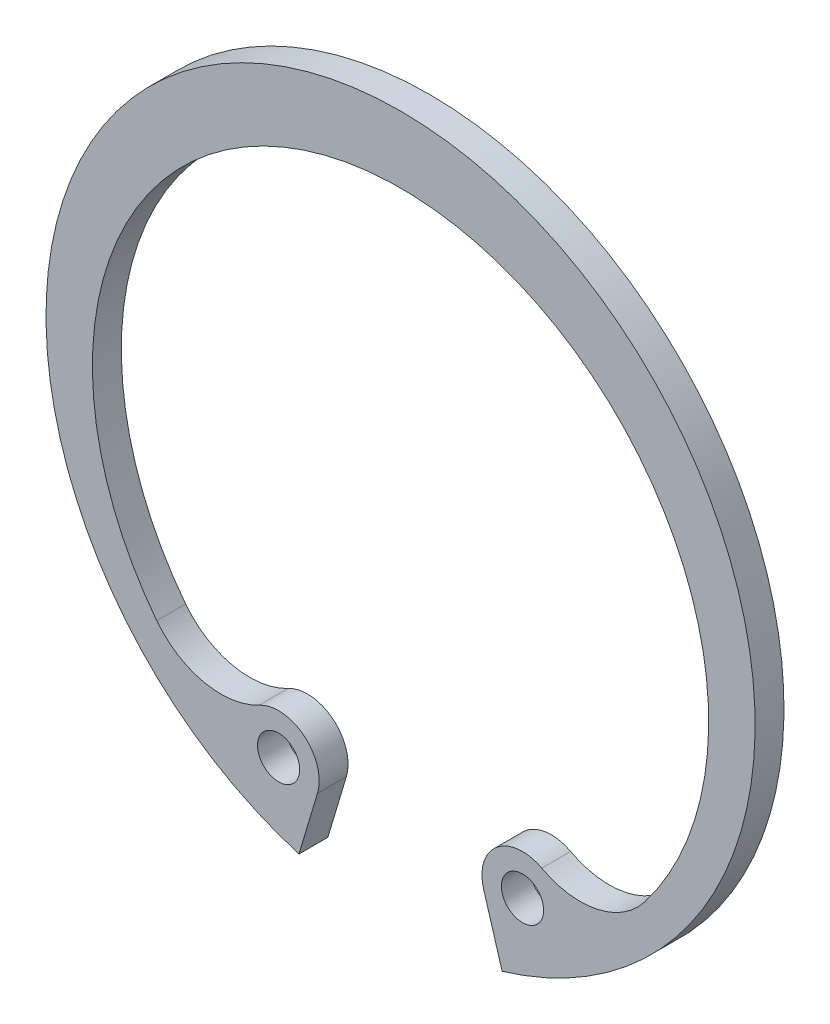
from build123d import *

# Parameters (mm, degrees)
SKETCH1_R  = 0.95
BODY_DEPTH = 1.3


with BuildPart() as part:
    # Sketch1 → Body (new body)
    with BuildSketch(Plane.XY):
        with BuildLine():
            Line((4.5689379, -15.281600259), (3.737645674, -12.501200135))
            ThreePointArc((3.737645674, -12.501200135), (4.333138487, -10.563802068), (6.350822113, -10.371251444))
            ThreePointArc((6.350822113, -10.371251444), (8.839654933, -10.727011842), (10.968132276, -9.388939173))
            ThreePointArc((10.968132276, -9.388939173), (0, 12.95), (-10.968132276, -9.388939173))
            ThreePointArc((-10.968132276, -9.388939173), (-8.839654933, -10.727011842), (-6.350822113, -10.371251444))
            ThreePointArc((-6.350822113, -10.371251444), (-4.333138487, -10.563802068), (-3.737645674, -12.501200135))
            Line((-3.737645674, -12.501200135), (-4.5689379, -15.281600259))
            ThreePointArc((-4.5689379, -15.281600259), (0, 15.95), (4.5689379, -15.281600259))
        make_face()
        with Locations((5.486167334, -11.978421974)):
            Circle(SKETCH1_R, mode=Mode.SUBTRACT)
        with Locations((-5.486167334, -11.978421974)):
            Circle(SKETCH1_R, mode=Mode.SUBTRACT)
    extrude(amount=-BODY_DEPTH)


solid = part.part
